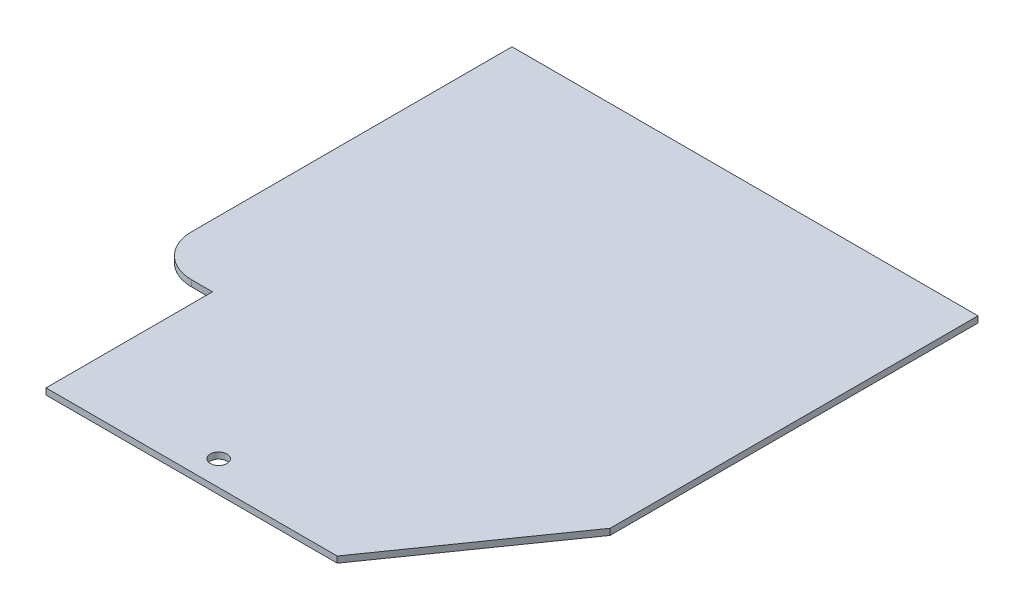
from build123d import *

# Parameters (mm, degrees)
IZIM15_R                    = 2
Y_KSEKLIK_EKSTR_ZYON1_DEPTH = 1.5


with BuildPart() as part:
    # Çizim15 → Yükseklik-Ekstrüzyon1 (new body)
    with BuildSketch(Plane(origin=(0, 0, 0), x_dir=(1, 0, 0), z_dir=(0, 1, 0))):
        with BuildLine():
            Line((0, 0), (70, 0))
            Line((70, 0), (97.008301528, 38.571851993))
            Line((97.008301528, 38.571851993), (97.008301528, 127))
            Line((97.008301528, 127), (-15, 127))
            Line((-15, 127), (-15, 55))
            Line((-15, 55), (-15, 50))
            ThreePointArc((-15, 50), (-12.071067812, 42.928932188), (-5, 40))
            Line((-5, 40), (0, 40))
            Line((0, 40), (0, 0))
        make_face()
        with Locations(Location((35.5, 6, 0), (0, 0, 270))):
            Circle(IZIM15_R, mode=Mode.SUBTRACT)
    extrude(amount=Y_KSEKLIK_EKSTR_ZYON1_DEPTH)


solid = part.part
